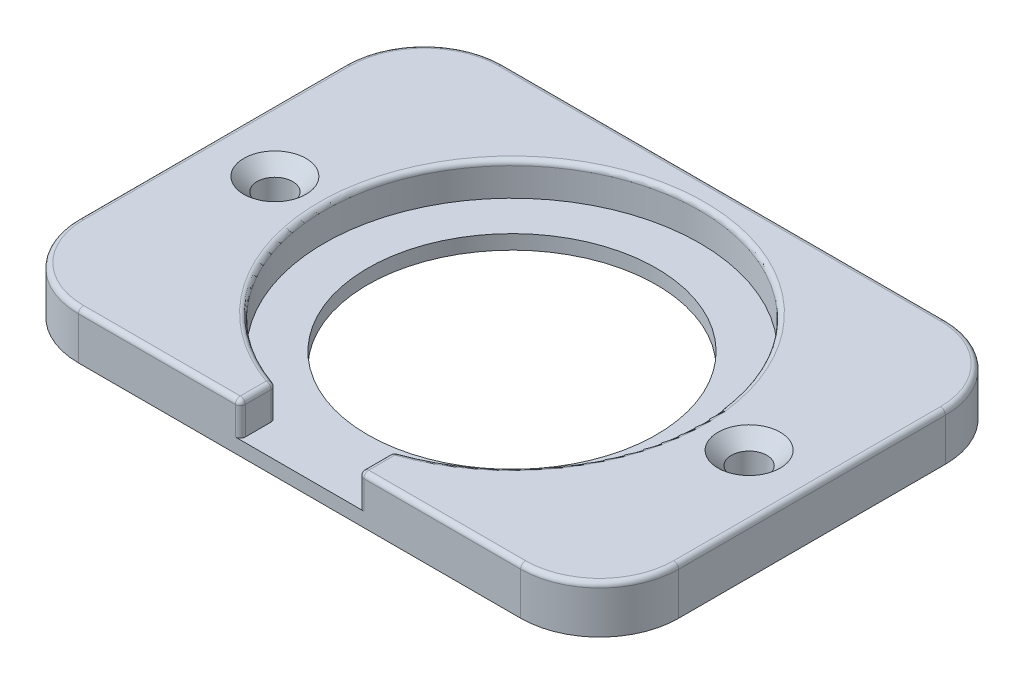
from build123d import *

# Parameters (mm, degrees)
SKETCH1_W                                       = 60.75
SKETCH1_H                                       = 43
BOSS_EXTRUDE1_DEPTH                             = 4.8
FILLET1_R                                       = 8
SKETCH2_R                                       = 19
CUT_EXTRUDE1_DEPTH                              = 3.35
SKETCH3_R                                       = 14.61
CUT_EXTRUDE2_DEPTH                              = 38.364597214
SKETCH4_W                                       = 12
SKETCH4_H                                       = 11.029070592
CUT_EXTRUDE3_DEPTH                              = 3.35
CSK_FOR_M3_FLAT_HEAD_MACHINE_SCREW1_D           = 3.6
CSK_FOR_M3_FLAT_HEAD_MACHINE_SCREW1_CSINK_D     = 6.3
CSK_FOR_M3_FLAT_HEAD_MACHINE_SCREW1_CSINK_ANGLE = 90
FILLET2_R                                       = 0.5


with BuildPart() as part:
    # Sketch1 → Boss-Extrude1 (new body)
    with BuildSketch(Plane(origin=(0, 0, 0), x_dir=(1, 0, 0), z_dir=(0, 1, 0))):
        Rectangle(SKETCH1_W, SKETCH1_H)
    extrude(amount=BOSS_EXTRUDE1_DEPTH)

    # Fillet1
    fillet1_edges = [part.edges().sort_by_distance(p)[0] for p in [
        (30.375, 2.4, 21.5),
        (-30.375, 2.4, 21.5),
        (-30.375, 2.4, -21.5),
        (30.375, 2.4, -21.5),
    ]]
    fillet(fillet1_edges, radius=FILLET1_R)

    # Sketch2 → Cut-Extrude1 (cut)
    with BuildSketch(Plane(origin=(0, 4.8, 0), x_dir=(1, 0, 0), z_dir=(0, 1, 0))):
        with Locations(Location((0, 0, 0), (0, 0, 270))):
            Circle(SKETCH2_R)
    extrude(amount=-CUT_EXTRUDE1_DEPTH, mode=Mode.SUBTRACT)

    # Sketch3 → Cut-Extrude2 (cut, through all)
    with BuildSketch(Plane(origin=(0, 1.45, 0), x_dir=(1, 0, 0), z_dir=(0, 1, 0))):
        with Locations(Location((0, 0, 0), (0, 0, 270))):
            Circle(SKETCH3_R)
    extrude(amount=-CUT_EXTRUDE2_DEPTH, mode=Mode.SUBTRACT)

    # Sketch4 → Cut-Extrude3 (cut)
    with BuildSketch(Plane(origin=(0, 4.8, 0), x_dir=(1, 0, 0), z_dir=(0, 1, 0))):
        with Locations((0, -19)):
            Rectangle(SKETCH4_W, SKETCH4_H)
    extrude(amount=-CUT_EXTRUDE3_DEPTH, mode=Mode.SUBTRACT)

    # CSK for M3 Flat Head Machine Screw1 (through all)
    with Locations(Plane(origin=(0, 4.8, 0), x_dir=(1, 0, 0), z_dir=(0, 1, 0))):
        with Locations((-24, 0), (0, 0)):
            csk_for_m3_flat_head_machine_screw1 = CounterSinkHole(CSK_FOR_M3_FLAT_HEAD_MACHINE_SCREW1_D / 2, CSK_FOR_M3_FLAT_HEAD_MACHINE_SCREW1_CSINK_D / 2, counter_sink_angle=CSK_FOR_M3_FLAT_HEAD_MACHINE_SCREW1_CSINK_ANGLE)

    # Mirror1: CSK for M3 Flat Head Machine Screw1 across plane
    add(csk_for_m3_flat_head_machine_screw1.mirror(Plane(origin=(0, 0, 0), x_dir=(0, 0, 1), z_dir=(1, 0, 0))), mode=Mode.SUBTRACT)

    # Fillet2
    fillet2_edges = [part.edges().sort_by_distance(p)[0] for p in [
        (-30.375, 4.8, 0),
        (0, 4.8, -21.5),
        (30.375, 4.8, 0),
        (-14.1875, 4.8, 21.5),
        (-28.031854249, 4.8, 19.156854249),
        (28.031854249, 4.8, 19.156854249),
        (28.031854249, 4.8, -19.156854249),
        (-28.031854249, 4.8, -19.156854249),
        (0, 4.8, -19),
        (14.1875, 4.8, 21.5),
        (6, 4.8, 19.763878189),
        (-6, 4.8, 19.763878189),
        (6, 3.125, 21.5),
        (6, 3.125, 18.027756377),
        (-6, 3.125, 21.5),
        (-6, 3.125, 18.027756377),
    ]]
    fillet(fillet2_edges, radius=FILLET2_R)


solid = part.part
